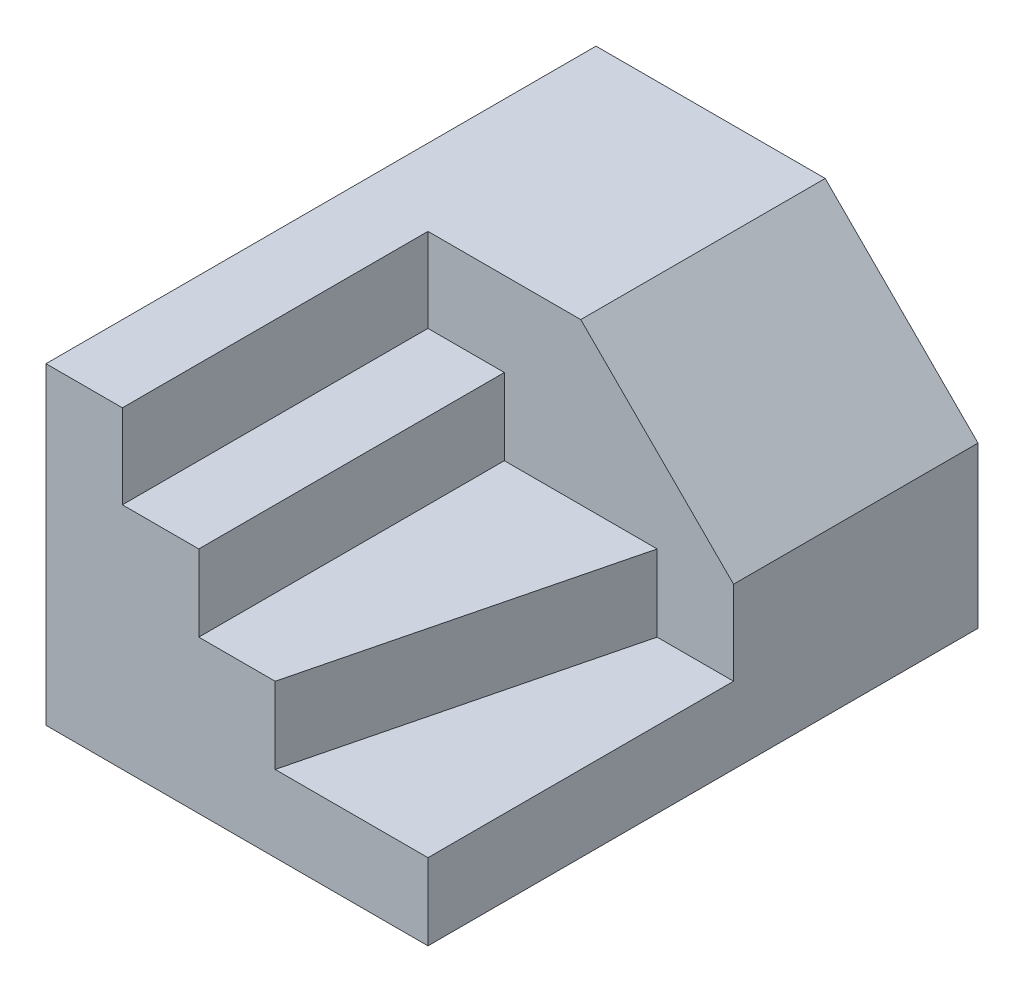
from build123d import *

# Parameters (mm, degrees)
SKETCH1_W           = 1270
SKETCH1_H           = 1828.8
BOSS_EXTRUDE1_DEPTH = 254
BOSS_EXTRUDE2_DEPTH = 812.8
SKETCH3_W           = 254
SKETCH3_H           = 1016
BOSS_EXTRUDE4_DEPTH = 787.4
SKETCH6_W           = 1016
SKETCH6_H           = 508
BOSS_EXTRUDE5_DEPTH = 254
BOSS_EXTRUDE6_DEPTH = 254


with BuildPart() as part:
    # Sketch1 → Boss-Extrude1 (new body)
    with BuildSketch(Plane(origin=(0, 0, 0), x_dir=(1, 0, 0), z_dir=(0, 1, 0))):
        with Locations((635, 914.4)):
            Rectangle(SKETCH1_W, SKETCH1_H)
    extrude(amount=BOSS_EXTRUDE1_DEPTH)

    # Sketch2 → Boss-Extrude2 (add)
    with BuildSketch(Plane(origin=(0, 0, -1828.8), x_dir=(-1, 0, 0), z_dir=(0, 0, -1))):
        Polygon((-1270, 254), (-1270, 533.4), (-762, 1041.4), (0, 1041.4), (0, 254), align=None)
    extrude(amount=-BOSS_EXTRUDE2_DEPTH)

    # Sketch3 → Boss-Extrude4 (add)
    with BuildSketch(Plane(origin=(0, 254, 0), x_dir=(1, 0, 0), z_dir=(0, 1, 0))):
        with Locations((127, 508)):
            Rectangle(SKETCH3_W, SKETCH3_H)
    extrude(amount=BOSS_EXTRUDE4_DEPTH)

    # Sketch6 → Boss-Extrude5 (add)
    with BuildSketch(Plane(origin=(254, 0, 0), x_dir=(0, 0, -1), z_dir=(1, 0, 0))):
        with Locations((508, 508)):
            Rectangle(SKETCH6_W, SKETCH6_H)
    extrude(amount=BOSS_EXTRUDE5_DEPTH)

    # Sketch7 → Boss-Extrude6 (add)
    with BuildSketch(Plane(origin=(0, 254, 0), x_dir=(1, 0, 0), z_dir=(0, 1, 0))):
        Polygon((508, 1016), (1016, 1016), (762, 0), (508, 0), align=None)
    extrude(amount=BOSS_EXTRUDE6_DEPTH)


solid = part.part
